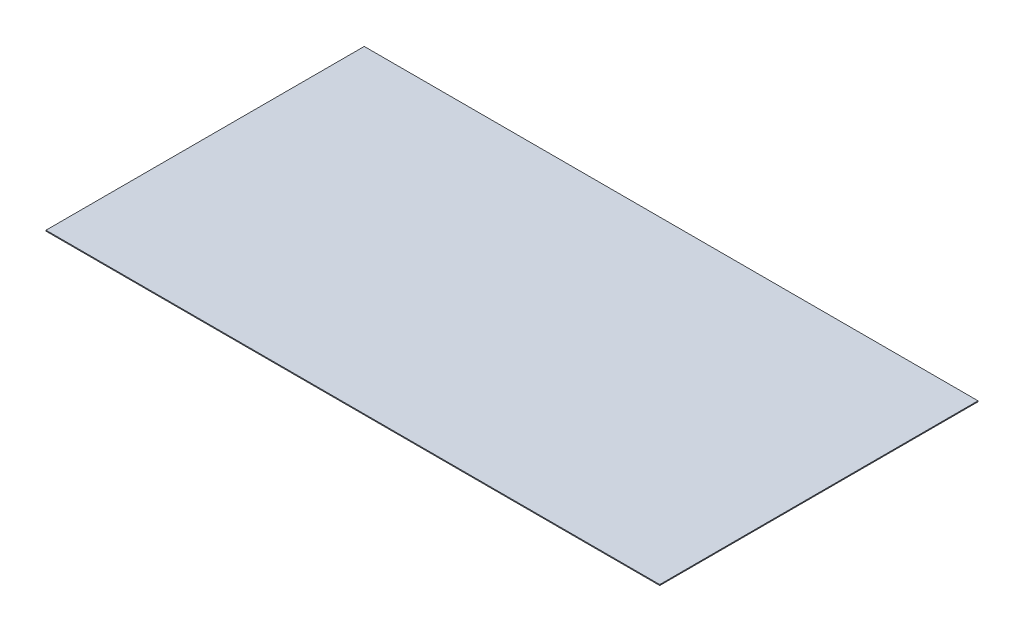
from build123d import *

# Parameters (mm, degrees)
MASTER_FOOTPRINT_W    = 1350
MASTER_FOOTPRINT_H    = 700
BATH_BASE_PLATE_DEPTH = 2


with BuildPart() as part:
    # MASTER_FOOTPRINT → BATH_BASE_PLATE (new body)
    with BuildSketch(Plane(origin=(0, 0, 0), x_dir=(1, 0, 0), z_dir=(0, 1, 0))):
        with Locations((675, 350)):
            Rectangle(MASTER_FOOTPRINT_W, MASTER_FOOTPRINT_H)
    extrude(amount=BATH_BASE_PLATE_DEPTH)


solid = part.part
